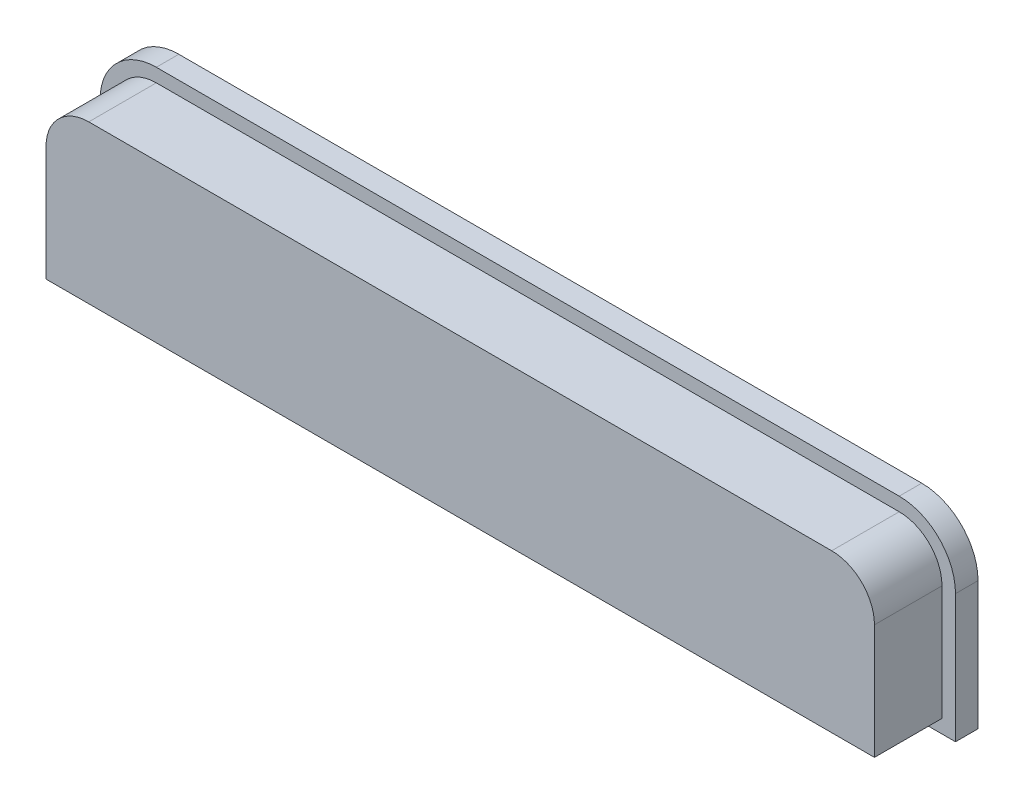
from build123d import *

# Parameters (mm, degrees)
BOSS_EXTRUDE1_DEPTH = 1
BOSS_EXTRUDE2_DEPTH = 3


with BuildPart() as part:
    # Sketch1 → Boss-Extrude1 (new body)
    with BuildSketch(Plane.XY):
        with BuildLine():
            Line((0, 0), (0, 5.7))
            ThreePointArc((0, 5.7), (0.732233047, 7.467766953), (2.5, 8.2))
            Line((2.5, 8.2), (35.5, 8.2))
            ThreePointArc((35.5, 8.2), (37.267766953, 7.467766953), (38, 5.7))
            Line((38, 5.7), (38, 0))
            Line((38, 0), (0, 0))
        make_face()
    extrude(amount=BOSS_EXTRUDE1_DEPTH)

    # Sketch2 → Boss-Extrude2 (add)
    with BuildSketch(Plane.XY.offset(1)):
        with BuildLine():
            Line((0.6, 0.6), (0.6, 5.7))
            ThreePointArc((0.6, 5.7), (1.156497116, 7.043502884), (2.5, 7.6))
            Line((2.5, 7.6), (35.5, 7.6))
            ThreePointArc((35.5, 7.6), (36.843502884, 7.043502884), (37.4, 5.7))
            Line((37.4, 5.7), (37.4, 0.6))
            Line((37.4, 0.6), (0.6, 0.6))
        make_face()
    extrude(amount=BOSS_EXTRUDE2_DEPTH)


solid = part.part
